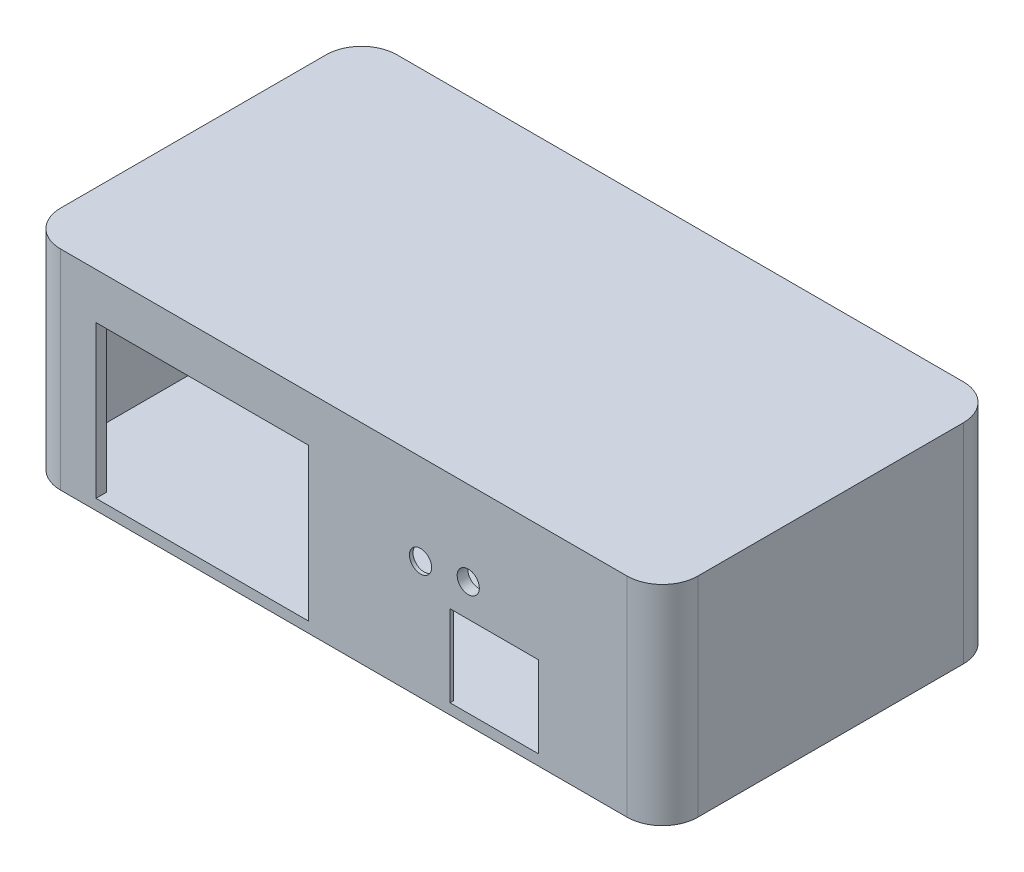
from build123d import *

# Parameters (mm, degrees)
SKETCH1_W           = 45.72
SKETCH1_H           = 24.13
BOSS_EXTRUDE1_DEPTH = 12.446
SHELL2_T            = -0.762
SKETCH2_W           = 22.606
SKETCH2_H           = 10.922
BOSS_EXTRUDE2_DEPTH = 0.762
FILLET1_R           = 2.54
SKETCH4_W           = 34.29
SKETCH4_H           = 3.81
SKETCH4_W_2         = 15.24
SKETCH4_H_2         = 2.54
CUT_EXTRUDE2_DEPTH  = 10.922
SKETCH6_W           = 6.35
SKETCH6_H           = 1.27
CUT_EXTRUDE3_DEPTH  = 10.922
SKETCH7_W           = 10.16
SKETCH7_H           = 10.922
CUT_EXTRUDE4_DEPTH  = 0.508
SKETCH8_R           = 3.175
SKETCH8_R_2         = 0.79375
BOSS_EXTRUDE3_DEPTH = 3.81
SKETCH9_R           = 1.27
SKETCH9_R_2         = 0.381
BOSS_EXTRUDE4_DEPTH = 2.286
CUT_EXTRUDE5_REACH  = 55.174
SKETCH10_R          = 0.79375
SKETCH10_R_2        = 0.381
BOSS_EXTRUDE5_START = -0.762
SKETCH11_R          = 0.381
BOSS_EXTRUDE5_DEPTH = 0.762
SKETCH12_R          = 0.79375
CUT_EXTRUDE6_DEPTH  = 0.762
SKETCH13_W          = 34.29
SKETCH13_H          = 5.08
BOSS_EXTRUDE6_DEPTH = 0.762
SKETCH14_R          = 0.79375
CUT_EXTRUDE7_DEPTH  = 54.174037048
BOSS_EXTRUDE7_START = 2.54
BOSS_EXTRUDE7_DEPTH = 2.54
SKETCH16_W          = 44.196
SKETCH16_H          = 22.606
CUT_EXTRUDE9_DEPTH  = 2.54
SKETCH18_W          = 6.35
SKETCH18_H          = 5.08
SKETCH18_R          = 0.79375
BOSS_EXTRUDE8_DEPTH = 0.762
CUT_EXTRUDE12_START = -2.54
SKETCH19_R          = 0.79375
CUT_EXTRUDE12_DEPTH = 2.54


with BuildPart() as part:
    # Sketch1 → Boss-Extrude1 (new body)
    with BuildSketch(Plane(origin=(0, 0, 0), x_dir=(1, 0, 0), z_dir=(0, 1, 0))):
        with Locations((22.86, 12.065)):
            Rectangle(SKETCH1_W, SKETCH1_H)
    extrude(amount=BOSS_EXTRUDE1_DEPTH)

    # Shell2
    shell2_openings = [part.faces().sort_by_distance(p)[0] for p in [
        (0, 6.223, -12.065),
    ]]
    offset(amount=SHELL2_T, openings=shell2_openings, kind=Kind.INTERSECTION)

    # Sketch2 → Boss-Extrude2 (add)
    with BuildSketch(Plane.ZY):
        with Locations((-12.065, 6.223)):
            Rectangle(SKETCH2_W, SKETCH2_H)
    extrude(amount=-BOSS_EXTRUDE2_DEPTH)

    # Fillet1
    fillet1_edges = [part.edges().sort_by_distance(p)[0] for p in [
        (0, 6.223, -24.13),
        (45.72, 6.223, -24.13),
        (45.72, 6.223, 0),
        (0, 6.223, 0),
    ]]
    fillet(fillet1_edges, radius=FILLET1_R)

    # Sketch4 → Cut-Extrude2 (cut)
    with BuildSketch(Plane(origin=(0, 0.762, 0), x_dir=(1, 0, 0), z_dir=(0, 1, 0))):
        with Locations((20.955, 23.495)):
            Rectangle(SKETCH4_W, SKETCH4_H)
        with Locations((12.7, 0)):
            Rectangle(SKETCH4_W_2, SKETCH4_H_2)
    extrude(amount=CUT_EXTRUDE2_DEPTH, mode=Mode.SUBTRACT)

    # Sketch6 → Cut-Extrude3 (cut)
    with BuildSketch(Plane(origin=(0, 0.762, 0), x_dir=(1, 0, 0), z_dir=(0, 1, 0))):
        with Locations((33.655, 0.635)):
            Rectangle(SKETCH6_W, SKETCH6_H)
    extrude(amount=CUT_EXTRUDE3_DEPTH, mode=Mode.SUBTRACT)

    # Sketch7 → Cut-Extrude4 (cut)
    with BuildSketch(Plane(origin=(0, 0, -0.762), x_dir=(-1, 0, 0), z_dir=(0, 0, -1))):
        with Locations((-25.4, 6.223)):
            Rectangle(SKETCH7_W, SKETCH7_H)
    extrude(amount=-CUT_EXTRUDE4_DEPTH, mode=Mode.SUBTRACT)

    # Sketch8 → Boss-Extrude3 (add)
    with BuildSketch(Plane(origin=(0, 0.762, 0), x_dir=(1, 0, 0), z_dir=(0, 1, 0))):
        with Locations(Location((13.462, 12.065, 0), (0, 0, 90))):
            Circle(SKETCH8_R)
        with Locations(Location((13.462, 12.065, 0), (0, 0, 90))):
            Circle(SKETCH8_R_2, mode=Mode.SUBTRACT)
    extrude(amount=BOSS_EXTRUDE3_DEPTH)

    # Sketch9 → Boss-Extrude4 (add)
    with BuildSketch(Plane(origin=(0, 0.762, 0), x_dir=(1, 0, 0), z_dir=(0, 1, 0))):
        with Locations(Location((27.50252945, 16.967141741, 0), (0, 0, 90))):
            Circle(SKETCH9_R)
        with Locations(Location((27.50252945, 16.967141741, 0), (0, 0, 270))):
            Circle(SKETCH9_R_2, mode=Mode.SUBTRACT)
    extrude(amount=BOSS_EXTRUDE4_DEPTH)

    # Sketch10 → Cut-Extrude5 (cut, up to next)
    with BuildSketch(Plane.XZ, mode=Mode.PRIVATE) as cut_extrude5_sk1:
        with Locations(Location((13.462, -12.065, 0), (0, 0, 270))):
            Circle(SKETCH10_R)
    cut_extrude5_tool1 = extrude(cut_extrude5_sk1.sketch, amount=-CUT_EXTRUDE5_REACH, mode=Mode.PRIVATE) & part.part
    # Sketch10 → Cut-Extrude5 (cut, up to next)
    with BuildSketch(Plane.XZ, mode=Mode.PRIVATE) as cut_extrude5_sk2:
        with Locations(Location((27.50252945, -16.967141741, 0), (0, 0, 270))):
            Circle(SKETCH10_R_2)
    cut_extrude5_tool2 = extrude(cut_extrude5_sk2.sketch, amount=-CUT_EXTRUDE5_REACH, mode=Mode.PRIVATE) & part.part
    # Sketch10 → Cut-Extrude5 (cut, up to next)
    with BuildSketch(Plane.XZ, mode=Mode.PRIVATE) as cut_extrude5_sk3:
        with Locations(Location((33.344788808, -6.833988408, 0), (0, 0, 270))):
            Circle(SKETCH10_R_2)
    cut_extrude5_tool3 = extrude(cut_extrude5_sk3.sketch, amount=-CUT_EXTRUDE5_REACH, mode=Mode.PRIVATE) & part.part
    add(cut_extrude5_tool1.solids().sort_by_distance((13.462, 0, -12.065))[0], mode=Mode.SUBTRACT)
    add(cut_extrude5_tool2.solids().sort_by_distance((27.502529, 0, -16.967142))[0], mode=Mode.SUBTRACT)
    add(cut_extrude5_tool3.solids().sort_by_distance((33.344789, 0, -6.833988))[0], mode=Mode.SUBTRACT)

    # Sketch11 → Boss-Extrude5 (add)
    with BuildSketch(Plane.XZ.offset(BOSS_EXTRUDE5_START)):
        with Locations(Location((27.50252945, -16.967141741, 0), (0, 0, 270))):
            Circle(SKETCH11_R)
        with Locations((33.344788808, -6.833988408)):
            Circle(SKETCH11_R)
    extrude(amount=BOSS_EXTRUDE5_DEPTH)

    # Sketch12 → Cut-Extrude6 (cut)
    with BuildSketch(Plane.XY):
        with Locations((28.36322115, 8.4984082)):
            Circle(SKETCH12_R)
    extrude(amount=-CUT_EXTRUDE6_DEPTH, mode=Mode.SUBTRACT)

    # Sketch13 → Boss-Extrude6 (add)
    with BuildSketch(Plane(origin=(0, 0, -24.13), x_dir=(-1, 0, 0), z_dir=(0, 0, -1))):
        with Locations((-20.955, 9.144)):
            Rectangle(SKETCH13_W, SKETCH13_H)
    extrude(amount=-BOSS_EXTRUDE6_DEPTH)

    # Sketch14 → Cut-Extrude7 (cut, through all)
    with BuildSketch(Plane(origin=(0, 0, -24.13), x_dir=(-1, 0, 0), z_dir=(0, 0, -1))):
        with Locations(Location((-28.36322115, 8.4984082, 0), (0, 0, 180))):
            Circle(SKETCH14_R)
    extrude(amount=-CUT_EXTRUDE7_DEPTH, mode=Mode.SUBTRACT)

    # Sketch15 → Boss-Extrude7 (add)
    with BuildSketch(Plane(origin=(0, 12.446, 0), x_dir=(1, 0, 0), z_dir=(0, 1, 0)).offset(BOSS_EXTRUDE7_START)):
        with BuildLine():
            Line((0, 2.54), (0, 21.59))
            ThreePointArc((0, 21.59), (0.743948776, 23.386051224), (2.54, 24.13))
            Line((2.54, 24.13), (43.18, 24.13))
            ThreePointArc((43.18, 24.13), (44.976051224, 23.386051224), (45.72, 21.59))
            Line((45.72, 21.59), (45.72, 2.54))
            ThreePointArc((45.72, 2.54), (44.976051224, 0.743948776), (43.18, 0))
            Line((43.18, 0), (2.54, 0))
            ThreePointArc((2.54, 0), (0.743948776, 0.743948776), (0, 2.54))
        make_face()
    extrude(amount=-BOSS_EXTRUDE7_DEPTH)

    # Sketch16 → Cut-Extrude9 (cut)
    with BuildSketch(Plane.XZ.offset(-11.684)):
        with Locations((22.86, -12.065)):
            Rectangle(SKETCH16_W, SKETCH16_H)
    extrude(amount=-CUT_EXTRUDE9_DEPTH, mode=Mode.SUBTRACT)

    # Sketch18 → Boss-Extrude8 (add)
    with BuildSketch(Plane.XY):
        with Locations((33.655, 9.144)):
            Rectangle(SKETCH18_W, SKETCH18_H)
        with Locations((31.786109402, 8.930211756)):
            Circle(SKETCH18_R, mode=Mode.SUBTRACT)
    extrude(amount=-BOSS_EXTRUDE8_DEPTH)

    # Sketch19 → Cut-Extrude12 (cut)
    with BuildSketch(Plane(origin=(0, 0, -24.13), x_dir=(-1, 0, 0), z_dir=(0, 0, -1)).offset(CUT_EXTRUDE12_START)):
        with Locations(Location((-31.786109402, 8.930211756, 0), (0, 0, 180))):
            Circle(SKETCH19_R)
    extrude(amount=CUT_EXTRUDE12_DEPTH, mode=Mode.SUBTRACT)


solid = part.part
